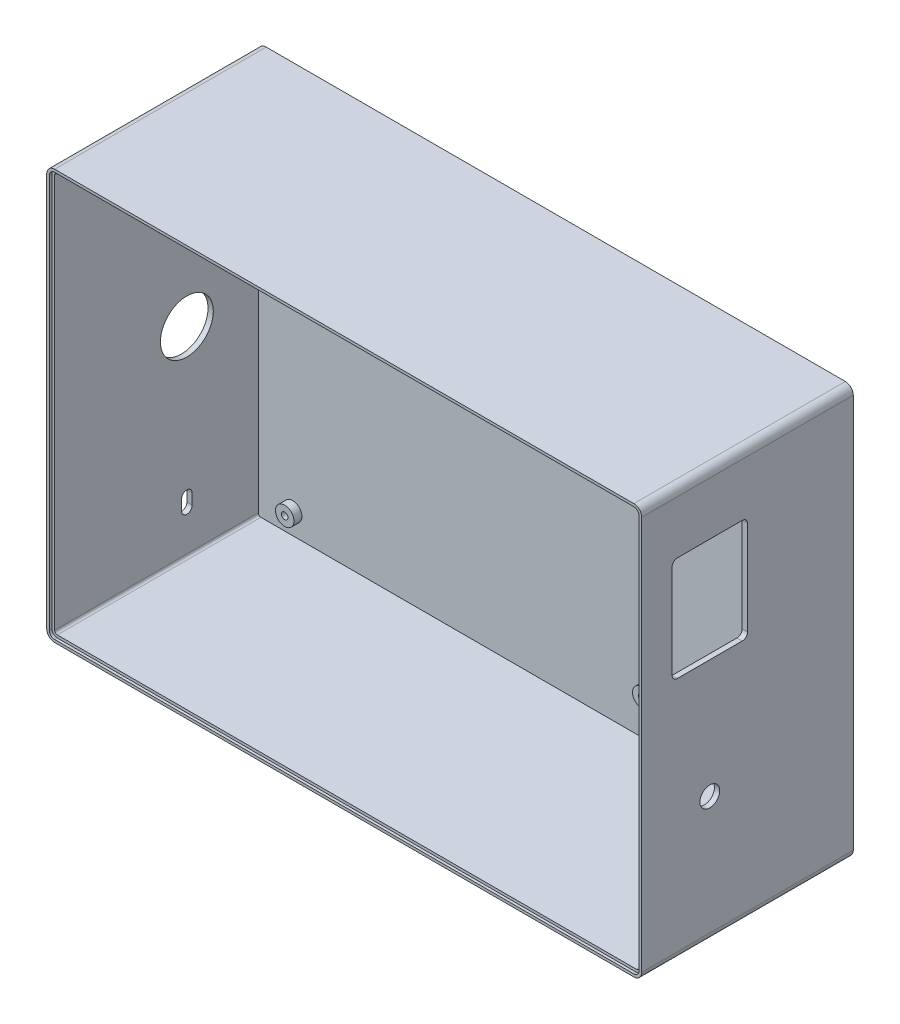
from build123d import *

# Parameters (mm, degrees)
SKETCH_1_W          = 225
SKETCH_1_H          = 155
EXTRUDE_1_DEPTH     = 80
FILLET_1_R          = 3
SHELL_1_T           = -2
SKETCH_2_R          = 3.5
SKETCH_2_R_2        = 1.25
EXTRUDE_2_DEPTH     = 5
SKETCH_4_W          = 28.5
SKETCH_4_H          = 39.5
CUT_EXTRUDE_3_DEPTH = 3
FILLET_2_R          = 2
SKETCH_5_R          = 10
CUT_EXTRUDE_4_DEPTH = 3
SKETCH_6_R          = 3.75
CUT_EXTRUDE_5_DEPTH = 3
CUT_EXTRUDE_6_DEPTH = 3
CUT_EXTRUDE_7_DEPTH = 1
SKETCH_9_R          = 3.5
EXTRUDE_4_DEPTH     = 3
SKETCH_10_R         = 1.25
CUT_EXTRUDE_8_DEPTH = 5
CUT_EXTRUDE_START   = -2
SKETCH_11_R         = 1.25
CUT_EXTRUDE_9_DEPTH = 2


with BuildPart() as part:
    # 草图1 → 凸台-拉伸1 (new body)
    with BuildSketch(Plane.XY):
        with Locations((112.5, -77.5)):
            Rectangle(SKETCH_1_W, SKETCH_1_H)
    extrude(amount=EXTRUDE_1_DEPTH)

    # 圆角1
    fillet_1_edges = [part.edges().sort_by_distance(p)[0] for p in [
        (0, 0, 40),
        (225, 0, 40),
        (225, -155, 40),
        (0, -155, 40),
    ]]
    fillet(fillet_1_edges, radius=FILLET_1_R)

    # 抽壳1
    shell_1_openings = [part.faces().sort_by_distance(p)[0] for p in [
        (112.5, -77.5, 80),
    ]]
    offset(amount=SHELL_1_T, openings=shell_1_openings, kind=Kind.INTERSECTION)

    # 草图2 → 凸台-拉伸2 (add)
    # profile 1 of 4: a face of its own
    with BuildSketch(Plane.XY.offset(2)):
        with Locations((217, -20)):
            Circle(SKETCH_2_R)
        with Locations((217, -20)):
            Circle(SKETCH_2_R_2, mode=Mode.SUBTRACT)
    # profile 2 of 4: a face of its own
    with BuildSketch(Plane.XY.offset(2)):
        with Locations((152, -20)):
            Circle(SKETCH_2_R)
        with Locations((152, -20)):
            Circle(SKETCH_2_R_2, mode=Mode.SUBTRACT)
    # profile 3 of 4: a face of its own
    with BuildSketch(Plane.XY.offset(2)):
        with Locations((152, -135)):
            Circle(SKETCH_2_R)
        with Locations((152, -135)):
            Circle(SKETCH_2_R_2, mode=Mode.SUBTRACT)
    # profile 4 of 4: a face of its own
    with BuildSketch(Plane.XY.offset(2)):
        with Locations((217, -135)):
            Circle(SKETCH_2_R)
        with Locations((217, -135)):
            Circle(SKETCH_2_R_2, mode=Mode.SUBTRACT)
    extrude(amount=EXTRUDE_2_DEPTH)

    # 草图4 → 切除-拉伸3 (cut)
    with BuildSketch(Plane(origin=(225, 0, 0), x_dir=(0, 0, -1), z_dir=(1, 0, 0))):
        with Locations((-54.25, -42.75)):
            Rectangle(SKETCH_4_W, SKETCH_4_H)
    extrude(amount=-CUT_EXTRUDE_3_DEPTH, mode=Mode.SUBTRACT)

    # 圆角2
    fillet_2_edges = [part.edges().sort_by_distance(p)[0] for p in [
        (224, -62.5, 68.5),
        (224, -23, 68.5),
        (224, -23, 40),
        (224, -62.5, 40),
    ]]
    fillet(fillet_2_edges, radius=FILLET_2_R)

    # 草图5 → 切除-拉伸4 (cut)
    with BuildSketch(Plane.ZY):
        with Locations((29, -77.5)):
            Circle(SKETCH_5_R)
    extrude(amount=-CUT_EXTRUDE_4_DEPTH, mode=Mode.SUBTRACT)

    # 草图6 → 切除-拉伸5 (cut)
    with BuildSketch(Plane(origin=(225, 0, 0), x_dir=(0, 0, -1), z_dir=(1, 0, 0))):
        with Locations(Location((-54.25, -107.25, 0), (0, 0, 90))):
            Circle(SKETCH_6_R)
    extrude(amount=-CUT_EXTRUDE_5_DEPTH, mode=Mode.SUBTRACT)

    # 草图7 → 切除-拉伸6 (cut)
    with BuildSketch(Plane.ZY):
        with BuildLine():
            Line((31, -133), (31, -137))
            ThreePointArc((31, -137), (29, -139), (27, -137))
            Line((27, -137), (27, -133))
            ThreePointArc((27, -133), (29, -131), (31, -133))
        make_face()
    extrude(amount=-CUT_EXTRUDE_6_DEPTH, mode=Mode.SUBTRACT)

    # 草图8 → 切除-拉伸7 (cut)
    with BuildSketch(Plane.XY.offset(80)):
        with BuildLine():
            Line((3, -154), (222, -154))
            ThreePointArc((222, -154), (223.414213562, -153.414213562), (224, -152))
            Line((224, -152), (224, -3))
            ThreePointArc((224, -3), (223.414213562, -1.585786438), (222, -1))
            Line((222, -1), (3, -1))
            ThreePointArc((3, -1), (1.585786438, -1.585786438), (1, -3))
            Line((1, -3), (1, -152))
            ThreePointArc((1, -152), (1.585786438, -153.414213562), (3, -154))
        make_face()
        with BuildLine():
            Line((3, -153), (222, -153))
            ThreePointArc((222, -153), (222.707106781, -152.707106781), (223, -152))
            Line((223, -152), (223, -3))
            ThreePointArc((223, -3), (222.707106781, -2.292893219), (222, -2))
            Line((222, -2), (3, -2))
            ThreePointArc((3, -2), (2.292893219, -2.292893219), (2, -3))
            Line((2, -3), (2, -152))
            ThreePointArc((2, -152), (2.292893219, -152.707106781), (3, -153))
        make_face(mode=Mode.SUBTRACT)
    extrude(amount=-CUT_EXTRUDE_7_DEPTH, mode=Mode.SUBTRACT)

    # 草图9 → 凸台-拉伸4 (add)
    with BuildSketch(Plane.XY.offset(2)):
        with Locations((15, -10)):
            Circle(SKETCH_9_R)
        with Locations((210, -10)):
            Circle(SKETCH_9_R)
        with Locations((210, -145)):
            Circle(SKETCH_9_R)
        with Locations((15, -145)):
            Circle(SKETCH_9_R)
    extrude(amount=EXTRUDE_4_DEPTH)

    # 草图10 → 切除-拉伸8 (cut)
    with BuildSketch(Plane.XY.offset(5)):
        with Locations((15, -10)):
            Circle(SKETCH_10_R)
        with Locations((210, -10)):
            Circle(SKETCH_10_R)
        with Locations((210, -145)):
            Circle(SKETCH_10_R)
        with Locations((15, -145)):
            Circle(SKETCH_10_R)
    extrude(amount=-CUT_EXTRUDE_8_DEPTH, mode=Mode.SUBTRACT)

    # 草图11 → 切除-拉伸9 (cut)
    with BuildSketch(Plane.XY.offset(2).offset(CUT_EXTRUDE_START)):
        with Locations((217, -20)):
            Circle(SKETCH_11_R)
        with Locations((152, -20)):
            Circle(SKETCH_11_R)
        with Locations((217, -135)):
            Circle(SKETCH_11_R)
        with Locations((152, -135)):
            Circle(SKETCH_11_R)
    extrude(amount=CUT_EXTRUDE_9_DEPTH, mode=Mode.SUBTRACT)


solid = part.part
